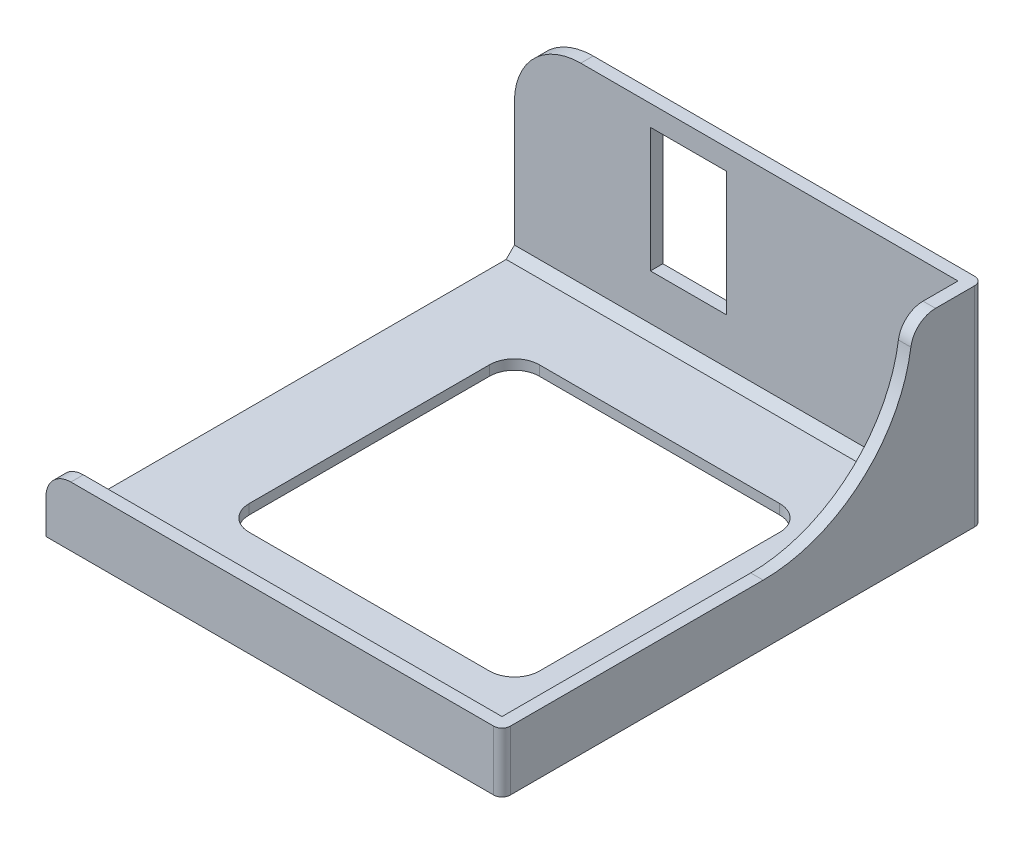
from build123d import *

# Parameters (mm, degrees)
ESBO_O1_W             = 55
ESBO_O1_H             = 58
BASE_DEPTH            = 1.2
ESBO_O2_W             = 55
ESBO_O2_H             = 58
ESBO_O2_W_2           = 52
ESBO_O2_H_2           = 55
PAREDES_DEPTH         = 24
ESBO_O3_W             = 4.971937724
ESBO_O3_H             = 55
CORTE_EXTRUS_O1_DEPTH = 24
ESBO_O4_W             = 9.2
ESBO_O4_H             = 15
ENCAIXE_CHAVE_DEPTH   = 17
ESBO_O5_W             = 1.5
ESBO_O5_H             = 18
CORTE_EXTRUS_O3_DEPTH = 68.089790579
ESBO_O6_W             = 30
ESBO_O6_H             = 18
CORTE_EXTRUS_O4_DEPTH = 17
FILETE1_R             = 8
FILETE2_R             = 3
FILETE3_R             = 3
FILETE4_R             = 1
FILETE5_R             = 1
CHANFRO1_SIZE         = 1
CORTE_EXTRUS_O5_DEPTH = 17


with BuildPart() as part:
    # Esboço1 → Base (new body)
    with BuildSketch(Plane(origin=(0, 0, 0), x_dir=(1, 0, 0), z_dir=(0, 1, 0))):
        Rectangle(ESBO_O1_W, ESBO_O1_H)
    extrude(amount=BASE_DEPTH)

    # Esboço2 → Paredes (add)
    with BuildSketch(Plane(origin=(0, 1.2, 0), x_dir=(1, 0, 0), z_dir=(0, 1, 0))):
        Rectangle(ESBO_O2_W, ESBO_O2_H)
        Rectangle(ESBO_O2_W_2, ESBO_O2_H_2, mode=Mode.SUBTRACT)
    extrude(amount=PAREDES_DEPTH)

    # Esboço3 → Corte-extrusão1 (cut)
    with BuildSketch(Plane(origin=(0, 25.2, 0), x_dir=(1, 0, 0), z_dir=(0, 1, 0))):
        with Locations((-27.5, 0)):
            Rectangle(ESBO_O3_W, ESBO_O3_H)
    extrude(amount=-CORTE_EXTRUS_O1_DEPTH, mode=Mode.SUBTRACT)

    # Esboço4 → Encaixe chave (cut)
    with BuildSketch(Plane(origin=(0, 0, -29), x_dir=(-1, 0, 0), z_dir=(0, 0, -1))):
        with Locations((6.5, 15.2)):
            Rectangle(ESBO_O4_W, ESBO_O4_H)
    extrude(amount=-ENCAIXE_CHAVE_DEPTH, mode=Mode.SUBTRACT)

    # Esboço5 → Corte-extrusão3 (cut, through all)
    with BuildSketch(Plane.ZY.offset(27.5)):
        with Locations((28.25, 16.2)):
            Rectangle(ESBO_O5_W, ESBO_O5_H)
    extrude(amount=-CORTE_EXTRUS_O3_DEPTH, mode=Mode.SUBTRACT)

    # Esboço6 → Corte-extrusão4 (cut)
    with BuildSketch(Plane(origin=(27.5, 0, 0), x_dir=(0, 0, -1), z_dir=(1, 0, 0))):
        with BuildLine():
            Line((20.5, 25.2), (2.5, 25.2))
            Line((2.5, 25.2), (2.5, 7.2))
            ThreePointArc((2.5, 7.2), (15.227922061, 12.472077939), (20.5, 25.2))
        make_face()
        with Locations((-12.5, 16.2)):
            Rectangle(ESBO_O6_W, ESBO_O6_H)
    extrude(amount=-CORTE_EXTRUS_O4_DEPTH, mode=Mode.SUBTRACT)

    # Filete1
    filete1_edges = [part.edges().sort_by_distance(p)[0] for p in [
        (-27.5, 25.2, -28.25),
    ]]
    fillet(filete1_edges, radius=FILETE1_R)

    # Filete2
    filete2_edges = [part.edges().sort_by_distance(p)[0] for p in [
        (-27.5, 7.2, 28.25),
    ]]
    fillet(filete2_edges, radius=FILETE2_R)

    # Filete3
    filete3_edges = [part.edges().sort_by_distance(p)[0] for p in [
        (26.75, 25.2, -20.5),
    ]]
    fillet(filete3_edges, radius=FILETE3_R)

    # Filete4
    filete4_edges = [part.edges().sort_by_distance(p)[0] for p in [
        (27.5, 3.6, 29),
    ]]
    fillet(filete4_edges, radius=FILETE4_R)

    # Filete5
    filete5_edges = [part.edges().sort_by_distance(p)[0] for p in [
        (27.5, 12.6, -29),
    ]]
    fillet(filete5_edges, radius=FILETE5_R)

    # Chanfro1
    chanfro1_edges = [part.edges().sort_by_distance(p)[0] for p in [
        (26, 1.2, 0),
        (-0.75, 1.2, -27.5),
        (-0.75, 1.2, 27.5),
    ]]
    chamfer(chanfro1_edges, length=CHANFRO1_SIZE)

    # Esboço7 → Corte-extrusão5 (cut)
    with BuildSketch(Plane(origin=(0, 1.2, 0), x_dir=(1, 0, 0), z_dir=(0, 1, 0))):
        with BuildLine():
            Line((-14.5, -17.5), (14.5, -17.5))
            ThreePointArc((14.5, -17.5), (16.621320344, -16.621320344), (17.5, -14.5))
            Line((17.5, -14.5), (17.5, 14.5))
            ThreePointArc((17.5, 14.5), (16.621320344, 16.621320344), (14.5, 17.5))
            Line((14.5, 17.5), (-14.5, 17.5))
            ThreePointArc((-14.5, 17.5), (-16.621320344, 16.621320344), (-17.5, 14.5))
            Line((-17.5, 14.5), (-17.5, -14.5))
            ThreePointArc((-17.5, -14.5), (-16.621320344, -16.621320344), (-14.5, -17.5))
        make_face()
    extrude(amount=-CORTE_EXTRUS_O5_DEPTH, mode=Mode.SUBTRACT)


solid = part.part
